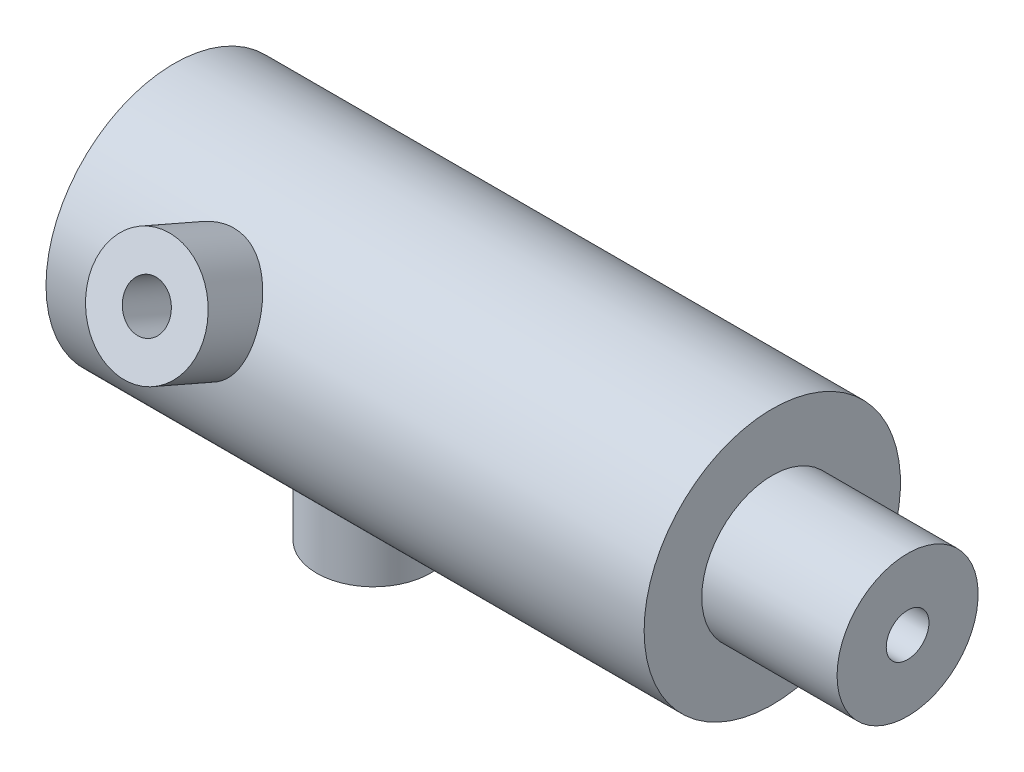
from build123d import *

# Parameters (mm, degrees)
NITROUS_BOSS_SKETCH_W          = 4
NITROUS_BOSS_SKETCH_H          = 7
ETHANOL_BOSS_SKETCH_W          = 4
ETHANOL_BOSS_SKETCH_H          = 7
CHAMBER_SKETCH_W               = 27.4
CHAMBER_SKETCH_H               = 5
FLAME_PASSAGE_SKETCH_W         = 16.5
FLAME_PASSAGE_SKETCH_H         = 1.5
PLUG_HOLE_SKETCH_W             = 9.6
PLUG_HOLE_SKETCH_H             = 4.5
NITROUS_SOCKET_SKETCH_W        = 1.6
NITROUS_SOCKET_SKETCH_H        = 7
NITROUS_ORIFICE_SKETCH_W       = 0.5
NITROUS_ORIFICE_SKETCH_H       = 2.5
ETHANOL_SOCKET_SKETCH_W        = 1.6
ETHANOL_SOCKET_SKETCH_H        = 7
ETHANOL_ORIFICE_SKETCH_W       = 0.5
ETHANOL_ORIFICE_SKETCH_H       = 2.5
NITROUS_SOCKET_RELIEF_SKETCH_W = 1.8
NITROUS_SOCKET_RELIEF_SKETCH_H = 1.5


with BuildPart() as part:
    # Body Sketch → Body (revolve)
    with BuildSketch(Plane.XY):
        Polygon((9.5, 0), (9.5, 4.953), (0, 4.953), (0, 9), (-42, 9), (-42, 0), align=None)
    revolve(axis=Axis((-300, 0, 0), (1, 0, 0)))

    # Nitrous Boss Sketch → Nitrous Boss (revolve)
    with BuildSketch(Plane.XY):
        with Locations((-26, -9.5)):
            Rectangle(NITROUS_BOSS_SKETCH_W, NITROUS_BOSS_SKETCH_H)
    revolve(axis=Axis((-28, -3, 0), (0, -1, 0)))

    # Ethanol Boss Sketch → Ethanol Boss (revolve)
    with BuildSketch(Plane(origin=(0, 0, 0), x_dir=(-1, 0, 0), z_dir=(0, -0.9169188892170476, 0.3990736155109426))):
        with Locations((30, -9.5)):
            Rectangle(ETHANOL_BOSS_SKETCH_W, ETHANOL_BOSS_SKETCH_H)
    revolve(axis=Axis((-32, 1.197220847, 2.750756668), (0, 0.39907361551094256, 0.9169188892170476)))

    # Chamber Sketch → Chamber (revolve, cut)
    with BuildSketch(Plane.XY):
        with Locations((-19.7, 2.5)):
            Rectangle(CHAMBER_SKETCH_W, CHAMBER_SKETCH_H)
    revolve(axis=Axis((-300, 0, 0), (1, 0, 0)), mode=Mode.SUBTRACT)

    # Flame Passage Sketch → Flame Passage (revolve, cut)
    with BuildSketch(Plane.XY):
        with Locations((2.25, 0.75)):
            Rectangle(FLAME_PASSAGE_SKETCH_W, FLAME_PASSAGE_SKETCH_H)
    revolve(axis=Axis((-300, 0, 0), (1, 0, 0)), mode=Mode.SUBTRACT)

    # Plug Hole Sketch → Plug Hole (revolve, cut)
    with BuildSketch(Plane.XY):
        with Locations((-38.2, 2.25)):
            Rectangle(PLUG_HOLE_SKETCH_W, PLUG_HOLE_SKETCH_H)
    revolve(axis=Axis((-300, 0, 0), (1, 0, 0)), mode=Mode.SUBTRACT)

    # Nitrous Socket Sketch → Nitrous Socket (revolve, cut)
    with BuildSketch(Plane.XY):
        with Locations((-27.2, -10.5)):
            Rectangle(NITROUS_SOCKET_SKETCH_W, NITROUS_SOCKET_SKETCH_H)
    revolve(axis=Axis((-28, -4, 0), (0, -1, 0)), mode=Mode.SUBTRACT)

    # Nitrous Orifice Sketch → Nitrous Orifice (revolve, cut)
    with BuildSketch(Plane.XY):
        with Locations((-27.75, -5.75)):
            Rectangle(NITROUS_ORIFICE_SKETCH_W, NITROUS_ORIFICE_SKETCH_H)
    revolve(axis=Axis((-28, -1.5, 0), (0, -1, 0)), mode=Mode.SUBTRACT)

    # Ethanol Socket Sketch → Ethanol Socket (revolve, cut)
    with BuildSketch(Plane(origin=(0, 0, 0), x_dir=(-1, 0, 0), z_dir=(0, -0.9169188892170476, 0.3990736155109426))):
        with Locations((31.2, -10.5)):
            Rectangle(ETHANOL_SOCKET_SKETCH_W, ETHANOL_SOCKET_SKETCH_H)
    revolve(axis=Axis((-32, 1.596294462, 3.667675557), (0, 0.39907361551094267, 0.9169188892170476)), mode=Mode.SUBTRACT)

    # Ethanol Orifice Sketch → Ethanol Orifice (revolve, cut)
    with BuildSketch(Plane(origin=(0, 0, 0), x_dir=(-1, 0, 0), z_dir=(0, -0.9169188892170476, 0.3990736155109426))):
        with Locations((31.75, -5.75)):
            Rectangle(ETHANOL_ORIFICE_SKETCH_W, ETHANOL_ORIFICE_SKETCH_H)
    revolve(axis=Axis((-32, 0.598610423, 1.375378334), (0, 0.39907361551094256, 0.9169188892170476)), mode=Mode.SUBTRACT)

    # Nitrous Socket Relief Sketch → Nitrous Socket Relief (revolve, cut)
    with BuildSketch(Plane.XY):
        with Locations((-27.1, -13.25)):
            Rectangle(NITROUS_SOCKET_RELIEF_SKETCH_W, NITROUS_SOCKET_RELIEF_SKETCH_H)
    revolve(axis=Axis((-28, -18, 0), (0, 1, 0)), mode=Mode.SUBTRACT)


solid = part.part
